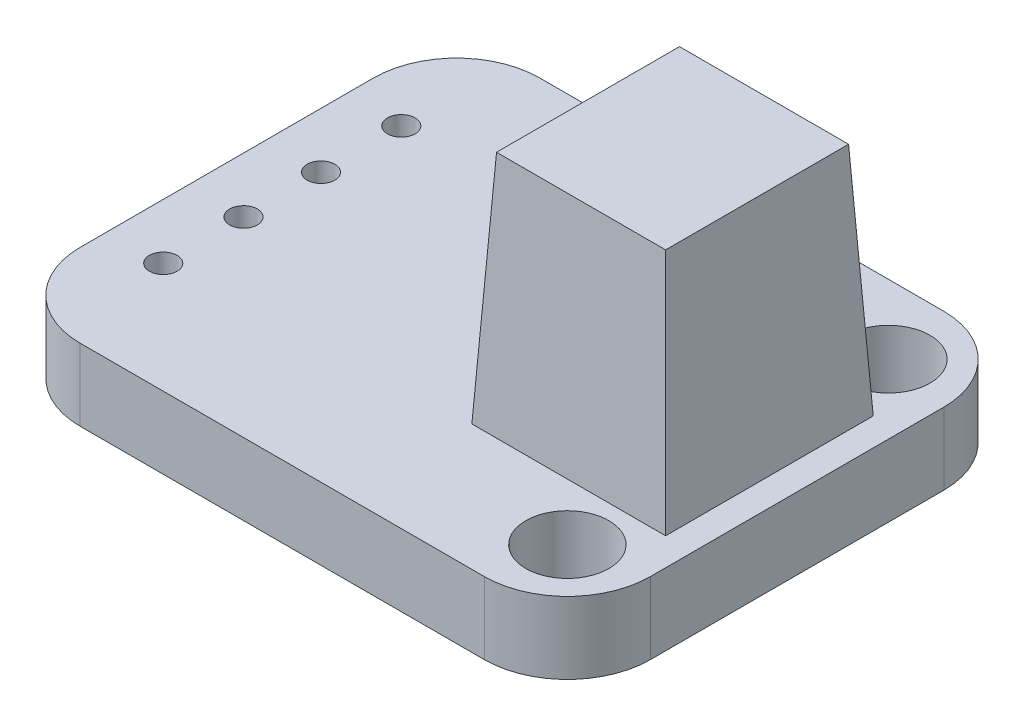
from build123d import *

# Parameters (mm, degrees)
SKETCH1_W           = 20.6
SKETCH1_H           = 16.6
BOSS_EXTRUDE1_DEPTH = 2.6
FILLET1_R           = 3
SKETCH2_R           = 1.5
CUT_EXTRUDE1_DEPTH  = 2.6
SKETCH3_W           = 7
SKETCH3_H           = 7.5
BOSS_EXTRUDE2_DEPTH = 8.5
BOSS_EXTRUDE2_TAPER = 3
SKETCH4_R           = 0.5
CUT_EXTRUDE2_DEPTH  = 8.5


with BuildPart() as part:
    # Sketch1 → Boss-Extrude1 (new body)
    with BuildSketch(Plane(origin=(0, 0, 0), x_dir=(1, 0, 0), z_dir=(0, 1, 0))):
        Rectangle(SKETCH1_W, SKETCH1_H)
    extrude(amount=BOSS_EXTRUDE1_DEPTH)

    # Fillet1
    fillet1_edges = [part.edges().sort_by_distance(p)[0] for p in [
        (10.3, 1.3, 8.3),
        (-10.3, 1.3, 8.3),
        (-10.3, 1.3, -8.3),
        (10.3, 1.3, -8.3),
    ]]
    fillet(fillet1_edges, radius=FILLET1_R)

    # Sketch2 → Cut-Extrude1 (cut)
    with BuildSketch(Plane(origin=(0, 2.6, 0), x_dir=(1, 0, 0), z_dir=(0, 1, 0))):
        with Locations(Location((7.8, 5.8, 0), (0, 0, 270))):
            Circle(SKETCH2_R)
        with Locations(Location((7.8, -5.8, 0), (0, 0, 270))):
            Circle(SKETCH2_R)
    extrude(amount=-CUT_EXTRUDE1_DEPTH, mode=Mode.SUBTRACT)

    # Sketch3 → Boss-Extrude2 (add)
    with BuildSketch(Plane(origin=(0, 2.6, 0), x_dir=(1, 0, 0), z_dir=(0, 1, 0))):
        with Locations((5.8, 0)):
            Rectangle(SKETCH3_W, SKETCH3_H)
    extrude(amount=BOSS_EXTRUDE2_DEPTH, taper=BOSS_EXTRUDE2_TAPER)

    # Sketch4 → Cut-Extrude2 (cut)
    with BuildSketch(Plane(origin=(0, 2.6, 0), x_dir=(1, 0, 0), z_dir=(0, 1, 0))):
        with Locations(Location((-8.3, 4.3, 0), (0, 0, 270))):
            Circle(SKETCH4_R)
        with Locations(Location((-8.3, -4.3, 0), (0, 0, 270))):
            Circle(SKETCH4_R)
        with Locations(Location((-8.3, -1.4, 0), (0, 0, 270))):
            Circle(SKETCH4_R)
        with Locations(Location((-8.3, 1.4, 0), (0, 0, 270))):
            Circle(SKETCH4_R)
    extrude(amount=-CUT_EXTRUDE2_DEPTH, mode=Mode.SUBTRACT)


solid = part.part
